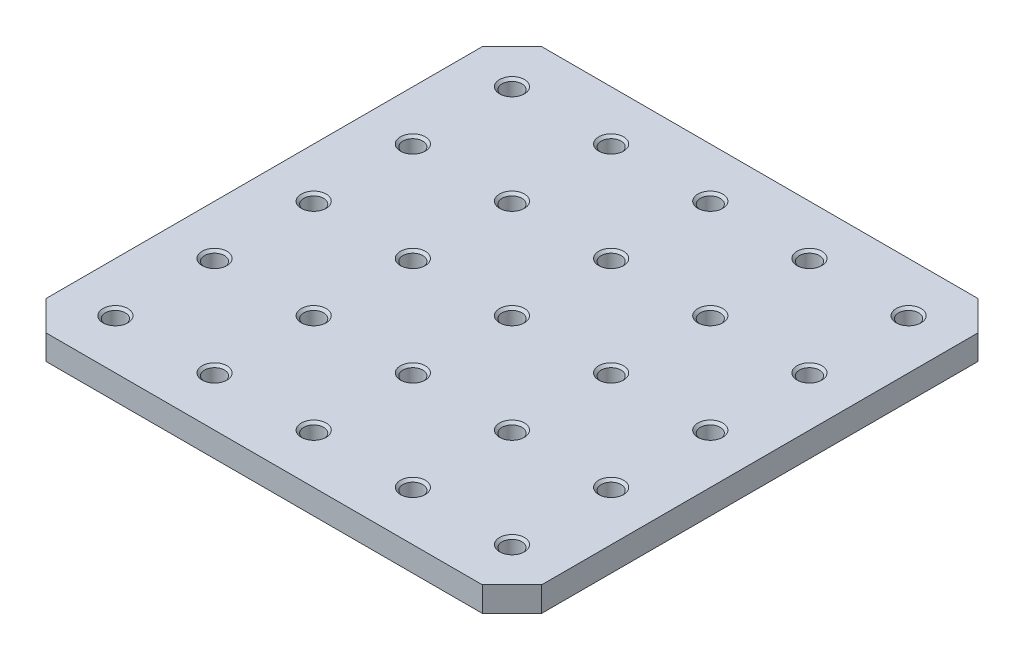
from build123d import *

# Parameters (mm, degrees)
SKETCH1_W                             = 127
SKETCH1_H                             = 127
BOSS_EXTRUDE1_DEPTH                   = 6.35
TAP_DRILL_FOR_1_4_20_TAP2_D           = 5.1054
TAP_DRILL_FOR_1_4_20_TAP2_CSINK_D     = 6.3754
TAP_DRILL_FOR_1_4_20_TAP2_CSINK_ANGLE = 90
LPATTERN1_COUNT                       = 5
LPATTERN1_PITCH                       = 25.4
LPATTERN1_COUNT_DIR2                  = 5
LPATTERN1_PITCH_DIR2                  = 25.4
CHAMFER1_SIZE                         = 7.62


with BuildPart() as part:
    # Sketch1 → Boss-Extrude1 (new body)
    with BuildSketch(Plane(origin=(0, 0, 0), x_dir=(1, 0, 0), z_dir=(0, 1, 0))):
        Rectangle(SKETCH1_W, SKETCH1_H)
    extrude(amount=BOSS_EXTRUDE1_DEPTH)

    # Tap Drill for 1/4-20 Tap2 (through all)
    with Locations(Plane(origin=(-50.8, 6.35, -50.8), x_dir=(0, 0, 1), z_dir=(0, 1, 0))):
        with Locations((0, 0)):
            tap_drill_for_1_4_20_tap2 = CounterSinkHole(TAP_DRILL_FOR_1_4_20_TAP2_D / 2, TAP_DRILL_FOR_1_4_20_TAP2_CSINK_D / 2, counter_sink_angle=TAP_DRILL_FOR_1_4_20_TAP2_CSINK_ANGLE)

    # LPattern1: Tap Drill for 1_4-20 Tap2 5 × 5
    with Locations(*[(j * LPATTERN1_PITCH_DIR2, 0, i * LPATTERN1_PITCH) for i in range(LPATTERN1_COUNT) for j in range(LPATTERN1_COUNT_DIR2) if (i, j) != (0, 0)]):
        add(tap_drill_for_1_4_20_tap2, mode=Mode.SUBTRACT)

    # Chamfer1
    chamfer1_edges = [part.edges().sort_by_distance(p)[0] for p in [
        (63.5, 3.175, 63.5),
        (-63.5, 3.175, 63.5),
        (-63.5, 3.175, -63.5),
        (63.5, 3.175, -63.5),
    ]]
    chamfer(chamfer1_edges, length=CHAMFER1_SIZE)


solid = part.part
